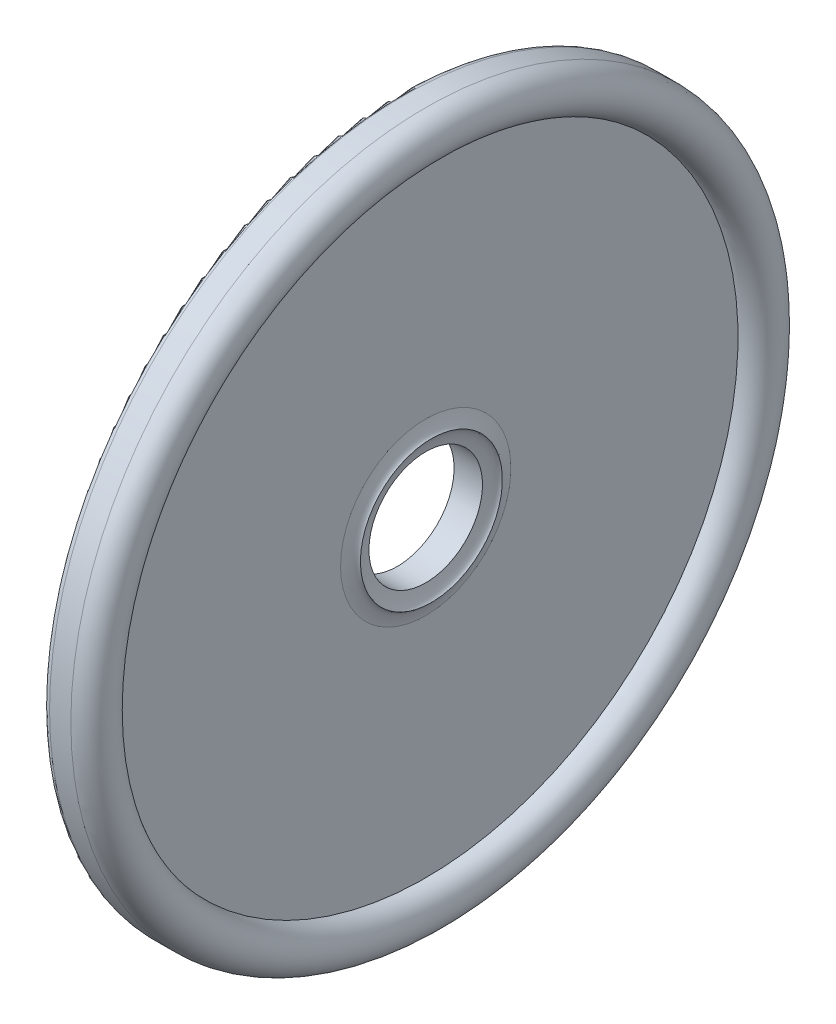
from build123d import *


with BuildPart() as part:
    # Sketch1 → Revolve1 (revolve)
    with BuildSketch(Plane(origin=(0, 0, 0), x_dir=(-1, 0, 0), z_dir=(0, 0, -1)), mode=Mode.PRIVATE) as revolve1_sk:
        with BuildLine():
            Line((-1, 11), (-1, 3))
            add(Edge.make_bspline(
                [(-1, 3), (-1.078203591, 2.575668755), (-1.2, 2.5)],
                knots=[0, 0, 0, 0.432994338, 0.432994338, 0.432994338], degree=2))
            add(Edge.make_bspline(
                [(-1, 2), (-1.078203591, 2.424331245), (-1.2, 2.5)],
                knots=[0, 0, 0, 0.432994338, 0.432994338, 0.432994338], degree=2))
            Line((-1, 2), (0, 2))
            Line((0, 2), (0, 12.25))
            ThreePointArc((0, 12.25), (-0.073223305, 12.426776695), (-0.25, 12.5))
            Line((-0.25, 12.5), (-1, 12.5))
            ThreePointArc((-1, 12.5), (-1.75, 11.75), (-1, 11))
        make_face()
    revolve(revolve1_sk.sketch.rotate(Axis((-1.443304251, 0, 0), (1, 0, 0)), 90), axis=Axis((-1.443304251, 0, 0), (1, 0, 0)))


solid = part.part
